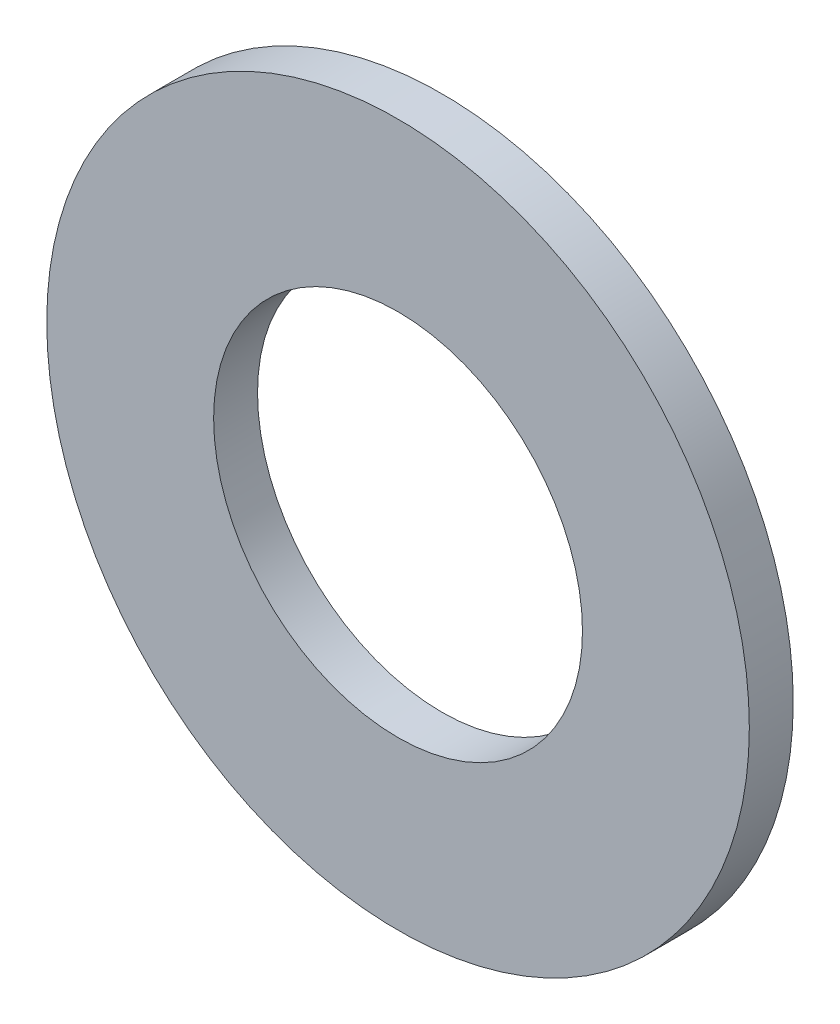
from build123d import *

# Parameters (mm, degrees)
WASHER_PROFILE_R   = 4
WASHER_PROFILE_R_2 = 2.1
WASHER_DEPTH       = 0.5


with BuildPart() as part:
    # Washer_profile → Washer (new body)
    with BuildSketch(Plane.XY):
        Circle(WASHER_PROFILE_R)
        Circle(WASHER_PROFILE_R_2, mode=Mode.SUBTRACT)
    extrude(amount=WASHER_DEPTH)


solid = part.part
